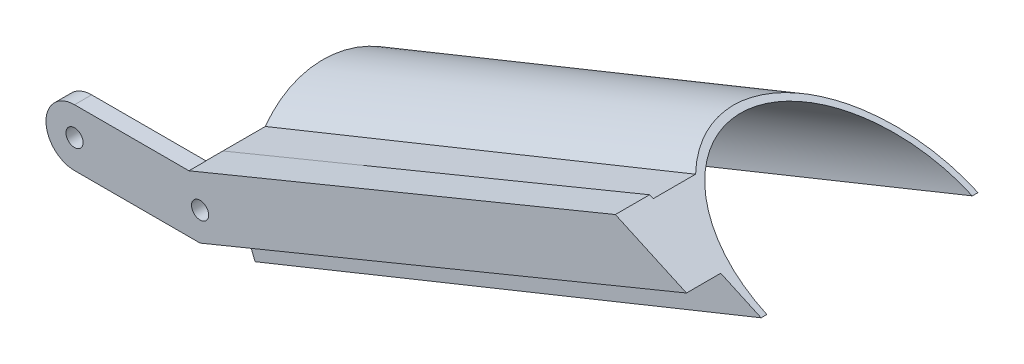
from build123d import *

# Parameters (mm, degrees)
SKETCH1_R           = 1.5
BOSS_EXTRUDE1_DEPTH = 3
EXTRUDE_1_DEPTH     = 3
EXTRUDE_2_DEPTH     = 3
EXTRUDE_3_REACH     = 100.745
CUT_EXTRUDE_1_DEPTH = 45


with BuildPart() as part:
    # Sketch1 → Boss-Extrude1 (new body)
    # profile 1 of 2: a face of its own
    with BuildSketch(Plane.XY):
        with BuildLine():
            Line((20.05, 5), (0, 5))
            ThreePointArc((0, 5), (-5, 0), (0, -5))
            Line((0, -5), (22, -5))
            Line((22, -5), (25.516973514, -3.553997369))
            ThreePointArc((25.516973514, -3.553997369), (26.624391141, 1.901317064), (22, 5))
            Line((22, 5), (20.05, 5))
        make_face()
        Circle(SKETCH1_R, mode=Mode.SUBTRACT)
        with Locations((22, 0)):
            Circle(SKETCH1_R, mode=Mode.SUBTRACT)
    # profile 2 of 2: a face of its own
    with BuildSketch(Plane.XY):
        with BuildLine():
            Line((46.409029503, 15.837507263), (20.05, 5))
            Line((20.05, 5), (22, 5))
            ThreePointArc((22, 5), (26.624391141, 1.901317064), (25.516973514, -3.553997369))
            Line((25.516973514, -3.553997369), (48.359029503, 5.837507263))
            Line((48.359029503, 5.837507263), (58.872830999, 10.16025367))
            Line((58.872830999, 10.16025367), (53.359871826, 12.67140304))
            Line((53.359871826, 12.67140304), (46.409029503, 15.837507263))
        make_face()
    extrude(amount=BOSS_EXTRUDE1_DEPTH)

    # 草图1 → 凸台-拉伸1 (add)
    with BuildSketch(Plane.XY.offset(3)):
        Polygon((46.409029503, 15.837507263), (58.872830999, 10.16025367), (111.008388469, 31.59577286), (98.544586973, 37.273026453), align=None)
    extrude(amount=-EXTRUDE_1_DEPTH)

    # 草图4 → 凸台-拉伸2 (add)
    with BuildSketch(Plane(origin=(0, 0, 0), x_dir=(-1, 0, 0), z_dir=(0, 0, -1))):
        with BuildLine():
            Line((-111.008388469, 31.59577286), (-98.544586973, 37.273026453))
            Line((-98.544586973, 37.273026453), (-19.990187018, 4.97540791))
            Line((-19.990187018, 4.97540791), (-21.063636635, 2.318021494))
            ThreePointArc((-21.063636635, 2.318021494), (-24.318021494, 0.936363365), (-22.936363365, -2.318021494))
            Line((-22.936363365, -2.318021494), (-23.732077199, -4.287856967))
            Line((-23.732077199, -4.287856967), (-111.008388469, 31.59577286))
        make_face()
    extrude(amount=EXTRUDE_2_DEPTH)

    # 凸台-拉伸3: up to this plane
    extrude_3_end = Plane(origin=(98.544586973, 37.273026453, -70.058401543), z_dir=(0.4145222599320868, 0.9100391727946636, 0))
    # 草图5 → 凸台-拉伸3 (add, up to the surface)
    with BuildSketch(Plane(origin=(18.913747244, 7.640196631, 0), x_dir=(0.3745453459539944, -0.9272085977945863, 0), z_dir=(-0.9272085977945863, -0.3745453459539944, 0)), mode=Mode.PRIVATE) as extrude_3_sk1:
        with BuildLine():
            Line((17.949999281, -3), (17.949999281, -4))
            ThreePointArc((17.949999281, -4), (-0.050000719, -22), (17.949999281, -40))
            Line((17.949999281, -40), (17.949999281, -41))
            ThreePointArc((17.949999281, -41), (0.910251194, -30.405176091), (2.873990521, -10.43652475))
            Line((2.873990521, -10.43652475), (2.873990521, -3))
            Line((2.873990521, -3), (17.949999281, -3))
        make_face()
    extrude_3_tool1 = split(extrude(extrude_3_sk1.sketch, amount=-EXTRUDE_3_REACH, mode=Mode.PRIVATE), bisect_by=extrude_3_end, keep=Keep.BOTH, mode=Mode.PRIVATE)
    add(extrude_3_tool1.solids().sort_by_distance((20.149314, 4.581481, -6.718262))[0])

    # 草图6 → 切除-拉伸1 (cut, symmetric)
    with BuildSketch(Plane(origin=(0, 0, 0), x_dir=(-1, 0, 0), z_dir=(0, 0, -1))):
        Polygon((-118.12130065, 28.35584592), (-94.278560376, 39.216198833), (-90.467733039, 37.676817461), (-114.310473313, 26.816464549), align=None)
    extrude(amount=CUT_EXTRUDE_1_DEPTH, both=True, mode=Mode.SUBTRACT)


solid = part.part
